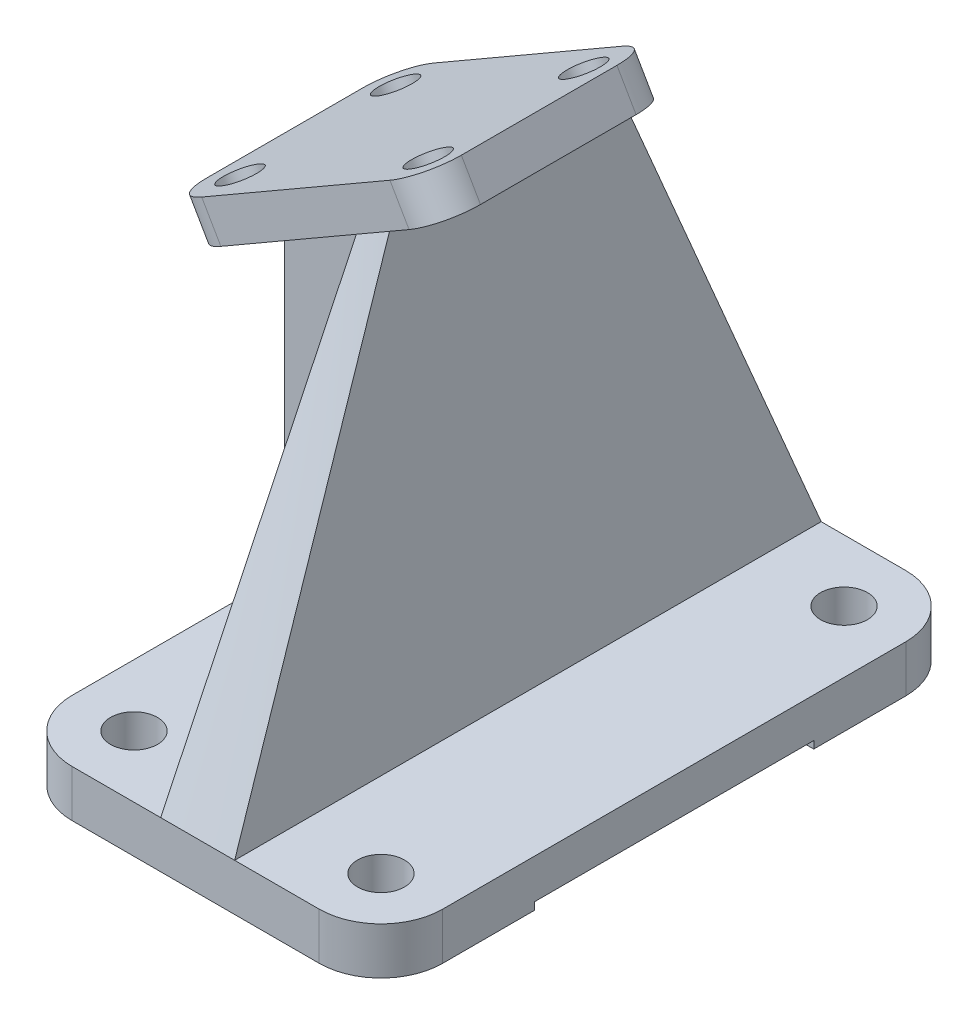
from build123d import *

# Parameters (mm, degrees)
SKETCH1_R           = 4.826
BOSS_EXTRUDE1_DEPTH = 9.652
SKETCH2_W           = 57.404
SKETCH2_H           = 3.048
CUT_EXTRUDE1_DEPTH  = 98.666302935
SKETCH5_W           = 60.452
SKETCH5_H           = 47.752
BOSS_EXTRUDE2_DEPTH = 7.874
FILLET1_R           = 7.874
SKETCH7_R           = 3.937
CUT_EXTRUDE2_DEPTH  = 7.874
RIB1_REACH          = 137.874
SKETCH11_WALL_W     = 341.312489082
SKETCH11_WALL_H     = 7.874


with BuildPart() as part:
    # Sketch1 → Boss-Extrude1 (new body)
    with BuildSketch(Plane(origin=(0, 0, 0), x_dir=(1, 0, 0), z_dir=(0, 1, 0))):
        with BuildLine():
            Line((-25.4, 60.325), (25.4, 60.325))
            ThreePointArc((25.4, 60.325), (34.380256121, 56.605256121), (38.1, 47.625))
            Line((38.1, 47.625), (38.1, -47.625))
            ThreePointArc((38.1, -47.625), (34.380256121, -56.605256121), (25.4, -60.325))
            Line((25.4, -60.325), (-25.4, -60.325))
            ThreePointArc((-25.4, -60.325), (-34.380256121, -56.605256121), (-38.1, -47.625))
            Line((-38.1, -47.625), (-38.1, 47.625))
            ThreePointArc((-38.1, 47.625), (-34.380256121, 56.605256121), (-25.4, 60.325))
        make_face()
        with Locations(Location((-25.4, -47.625, 0), (0, 0, 270))):
            Circle(SKETCH1_R, mode=Mode.SUBTRACT)
        with Locations(Location((25.4, -47.625, 0), (0, 0, 270))):
            Circle(SKETCH1_R, mode=Mode.SUBTRACT)
        with Locations(Location((25.4, 47.625, 0), (0, 0, 270))):
            Circle(SKETCH1_R, mode=Mode.SUBTRACT)
        with Locations(Location((-25.4, 47.625, 0), (0, 0, 270))):
            Circle(SKETCH1_R, mode=Mode.SUBTRACT)
    extrude(amount=BOSS_EXTRUDE1_DEPTH)

    # Sketch2 → Cut-Extrude1 (cut, through all)
    with BuildSketch(Plane.ZY.offset(38.1)):
        Rectangle(SKETCH2_W, SKETCH2_H)
    extrude(amount=-CUT_EXTRUDE1_DEPTH, mode=Mode.SUBTRACT)



with BuildPart() as body_2:
    # Sketch5 → Boss-Extrude2 (new body)
    with BuildSketch(Plane(origin=(-42.960508789, 74.409783942, 0), x_dir=(0.8660254037844399, 0.49999999999999795, 0), z_dir=(0.4999999999999979, -0.8660254037844398, 0))):
        with Locations((35.838432116, 0)):
            Rectangle(SKETCH5_W, SKETCH5_H)
    extrude(amount=-BOSS_EXTRUDE2_DEPTH)

    # Fillet1
    fillet1_edges = [body_2.edges().sort_by_distance(p)[0] for p in [
        (-40.0685, 80.625542015, 23.876),
        (12.28446771, 110.851542015, 23.876),
        (12.28446771, 110.851542015, -23.876),
        (-40.0685, 80.625542015, -23.876),
    ]]
    fillet(fillet1_edges, radius=FILLET1_R)

    # Sketch7 → Cut-Extrude2 (cut)
    with BuildSketch(Plane(origin=(-46.897508789, 81.228867971, 0), x_dir=(0.8660254037844398, 0.49999999999999806, 0), z_dir=(-0.499999999999998, 0.8660254037844397, 0))):
        with Locations(Location((13.486432116, 16.002, 0), (0, 0, 180))):
            Circle(SKETCH7_R)
        with Locations(Location((13.486432116, -16.002, 0), (0, 0, 180))):
            Circle(SKETCH7_R)
        with Locations(Location((58.190432116, -16.002, 0), (0, 0, 180))):
            Circle(SKETCH7_R)
        with Locations(Location((58.190432116, 16.002, 0), (0, 0, 180))):
            Circle(SKETCH7_R)
    extrude(amount=-CUT_EXTRUDE2_DEPTH, mode=Mode.SUBTRACT)


with BuildPart() as part_1:
    add(part.part)

    add(body_2.part)  # Loft1 merges body 2
    # Sketch3 → Loft1 section 0
    with BuildSketch(Plane(origin=(0, 9.652, 0), x_dir=(1, 0, 0), z_dir=(0, 1, 0))):
        with BuildLine():
            Line((8.005076562, 60.325), (-7.211701075, 60.325))
            Line((-7.211701075, 60.325), (-7.211701075, -60.325))
            Line((-7.211701075, -60.325), (8.005076562, -60.325))
            Line((8.005076562, -60.325), (8.005076562, 60.325))
        make_face()
    # Sketch10 → Loft1 section 1
    with BuildSketch(Plane(origin=(-42.960508789, 74.409783942, 0), x_dir=(0.8660254037844398, 0.49999999999999806, 0), z_dir=(0.499999999999998, -0.8660254037844397, 0))):
        with BuildLine():
            Line((53.543522628, 23.876), (45.669522628, 23.876))
            Line((45.669522628, 23.876), (45.669522628, -23.876))
            Line((45.669522628, -23.876), (53.543522628, -23.876))
            Line((53.543522628, -23.876), (53.543522628, 23.876))
        make_face()
    loft()

    # Sketch11 wall → Rib1 (add, up to next)
    with BuildSketch(Plane(origin=(-38.1, 43.434, 0), x_dir=(0, 1, 0), z_dir=(-1, 0, 0)), mode=Mode.PRIVATE) as rib1_sk1:
        Rectangle(SKETCH11_WALL_W, SKETCH11_WALL_H)
    rib1_tool1 = extrude(rib1_sk1.sketch, amount=-RIB1_REACH, mode=Mode.PRIVATE) - part_1.part
    add(rib1_tool1.solids().sort_by_distance((-38.1, 43.434, 0))[0])


solid = part_1.part
